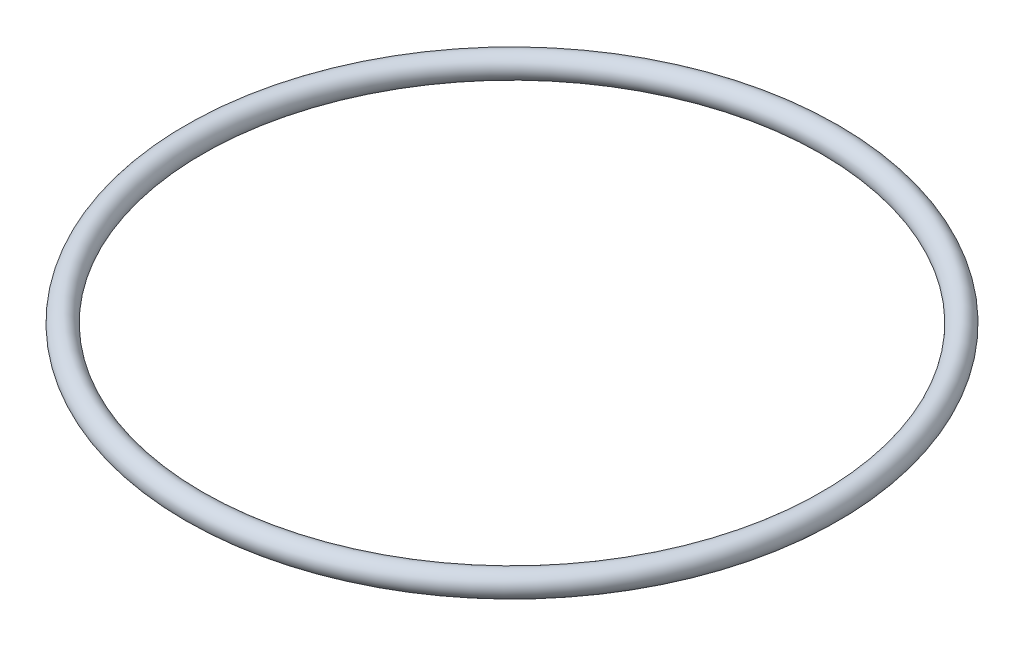
from build123d import *

# Parameters (mm, degrees)
SKETCH1_R = 0.5


with BuildPart() as part:
    # Sketch1 → Revolve1 (revolve)
    with BuildSketch(Plane.XY, mode=Mode.PRIVATE) as revolve1_sk:
        with Locations((13.5, 0)):
            Circle(SKETCH1_R)
    revolve(revolve1_sk.sketch.rotate(Axis((0, 0, 0), (0, 1, 0)), 90), axis=Axis((0, 0, 0), (0, 1, 0)))


solid = part.part
